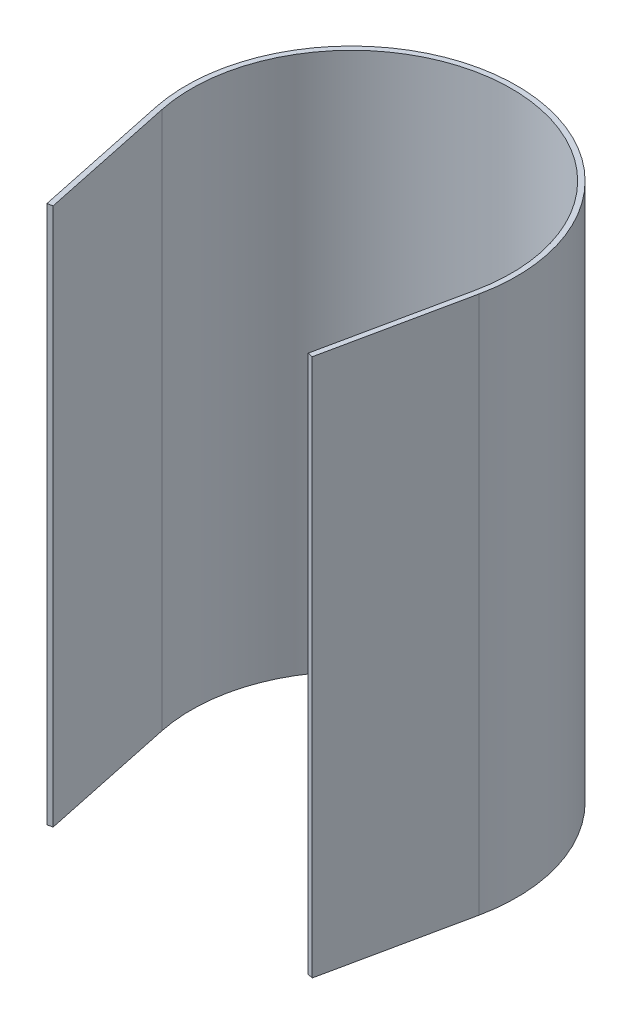
from build123d import *

# Parameters (mm, degrees)
ELECTRONICS_GLASS_EXTRUDE_DEPTH = 2050


with BuildPart() as part:
    # Electronics Glass Sketch → Electronics Glass Extrude (new body)
    with BuildSketch(Plane(origin=(0, 0, 0), x_dir=(1, 0, 0), z_dir=(0, 1, 0))):
        with BuildLine():
            Line((616.097304934, -129.692986908), (505.548652467, -654.846493454))
            Line((505.548652467, -654.846493454), (485.977581789, -650.726639994))
            Line((485.977581789, -650.726639994), (596.526234256, -125.573133448))
            ThreePointArc((596.526234256, -125.573133448), (606.322749203, -63.125936022), (609.6, 0))
            ThreePointArc((609.6, 0), (0, 609.6), (-609.6, 0))
            ThreePointArc((-609.6, 0), (-606.322749203, -63.125936022), (-596.526234256, -125.573133448))
            Line((-596.526234256, -125.573133448), (-485.977581789, -650.726639994))
            Line((-485.977581789, -650.726639994), (-505.548652467, -654.846493454))
            Line((-505.548652467, -654.846493454), (-616.097304934, -129.692986908))
            ThreePointArc((-616.097304934, -129.692986908), (0, 629.6), (616.097304934, -129.692986908))
        make_face()
    extrude(amount=ELECTRONICS_GLASS_EXTRUDE_DEPTH)


solid = part.part
